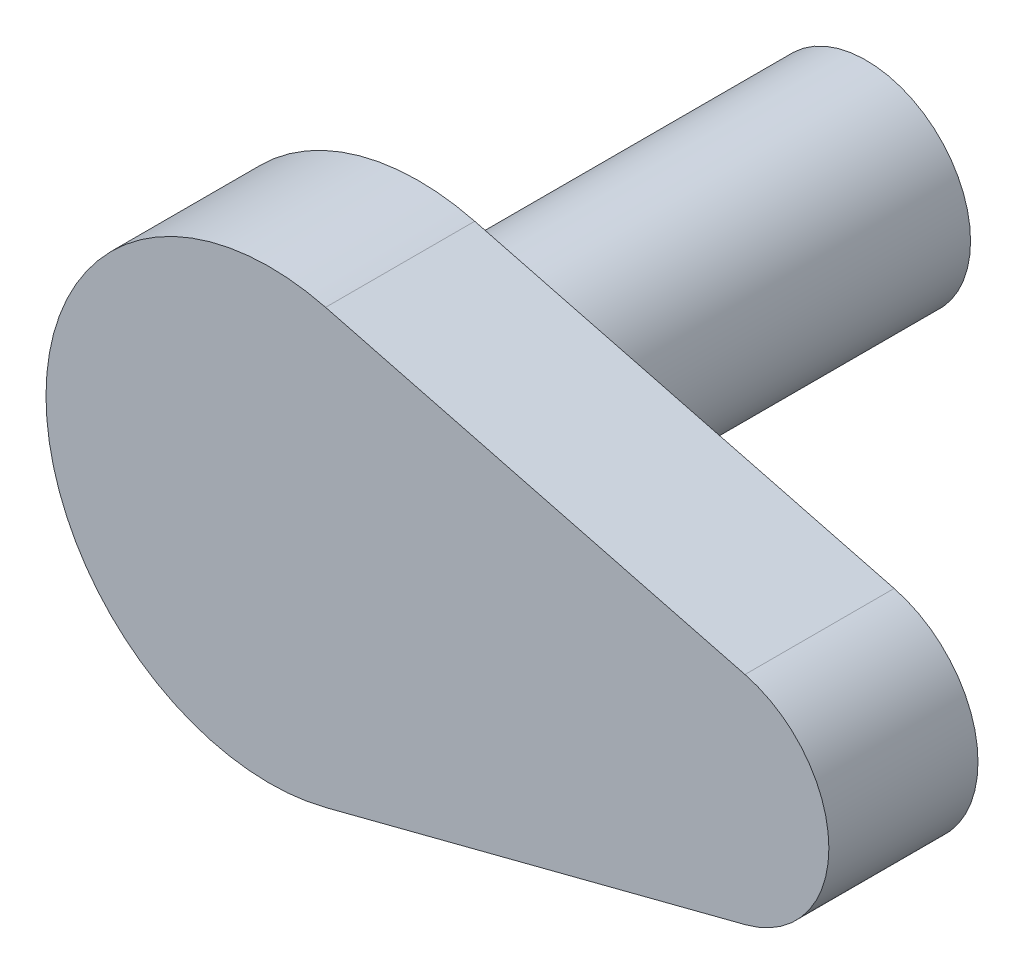
from build123d import *

# Parameters (mm, degrees)
SKETCH1_R           = 7
BOSS_EXTRUDE1_DEPTH = 30
BOSS_EXTRUDE2_DEPTH = 10


with BuildPart() as part:
    # Sketch1 → Boss-Extrude1 (new body)
    with BuildSketch(Plane.XY):
        Circle(SKETCH1_R)
    extrude(amount=BOSS_EXTRUDE1_DEPTH)

    # Sketch2 → Boss-Extrude2 (add)
    with BuildSketch(Plane.XY.offset(30)):
        with BuildLine():
            Line((3.75, 14.523687548), (31.875, 7.261843774))
            ThreePointArc((31.875, 7.261843774), (37.5, 0), (31.875, -7.261843774))
            Line((31.875, -7.261843774), (3.75, -14.523687548))
            ThreePointArc((3.75, -14.523687548), (-15, 0), (3.75, 14.523687548))
        make_face()
    extrude(amount=BOSS_EXTRUDE2_DEPTH)


solid = part.part
